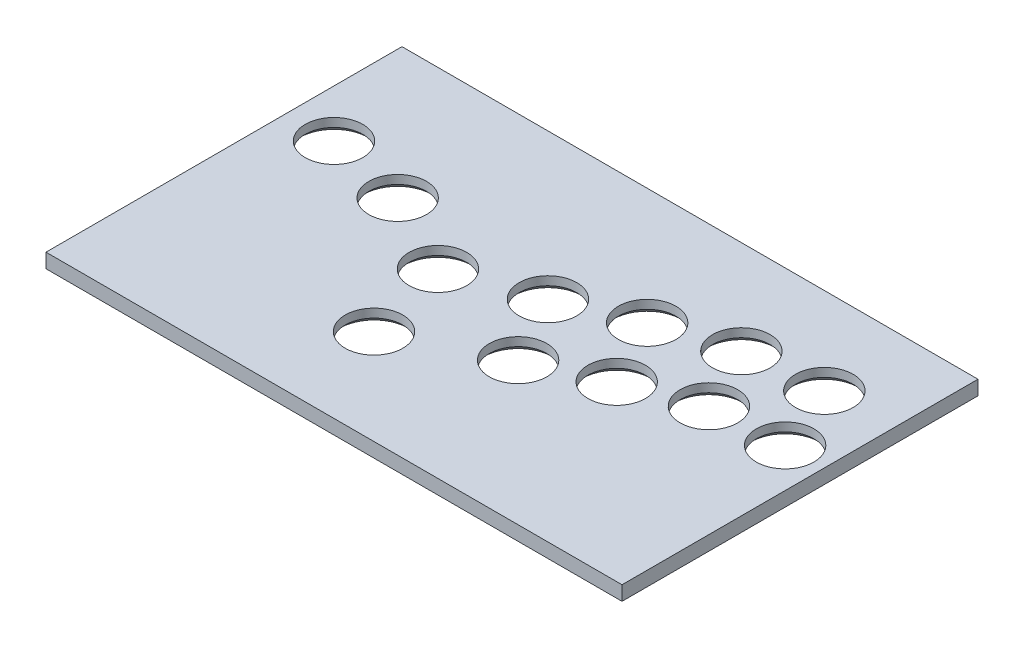
from build123d import *

# Parameters (mm, degrees)
SKETCH1_W           = 200
SKETCH1_H           = 123.6
SKETCH1_R           = 10
BOSS_EXTRUDE1_DEPTH = 5
CHAMFER1_SIZE       = 2


with BuildPart() as part:
    # Sketch1 → Boss-Extrude1 (new body)
    with BuildSketch(Plane(origin=(0, 0, 0), x_dir=(1, 0, 0), z_dir=(0, 1, 0))):
        with Locations((-11.382571905, -37.613815878)):
            Rectangle(SKETCH1_W, SKETCH1_H)
        with Locations(Location((-30.546222192, -66.351509684, 0), (0, 0, 270))):
            Circle(SKETCH1_R, mode=Mode.SUBTRACT)
        with Locations(Location((-66.632534539, -22.057178609, 0), (0, 0, 270))):
            Circle(SKETCH1_R, mode=Mode.SUBTRACT)
        with Locations(Location((-94.823650655, -15.979370187, 0), (0, 0, 270))):
            Circle(SKETCH1_R, mode=Mode.SUBTRACT)
        with Locations(Location((-10.090347172, -26.425303761, 0), (0, 0, 270))):
            Circle(SKETCH1_R, mode=Mode.SUBTRACT)
        with Locations(Location((65.449469323, -6.002101711, 0), (0, 0, 270))):
            Circle(SKETCH1_R, mode=Mode.SUBTRACT)
        with Locations(Location((39.120524561, -8.47636758, 0), (0, 0, 270))):
            Circle(SKETCH1_R, mode=Mode.SUBTRACT)
        with Locations(Location((3.050131898, -49.923740932, 0), (0, 0, 270))):
            Circle(SKETCH1_R, mode=Mode.SUBTRACT)
        with Locations(Location((26.684644812, -39.329734959, 0), (0, 0, 270))):
            Circle(SKETCH1_R, mode=Mode.SUBTRACT)
        with Locations(Location((50.034895937, -30.657694114, 0), (0, 0, 270))):
            Circle(SKETCH1_R, mode=Mode.SUBTRACT)
        with Locations(Location((-38.286901535, -36.422907606, 0), (0, 0, 270))):
            Circle(SKETCH1_R, mode=Mode.SUBTRACT)
        with Locations(Location((75.040753418, -29.205017129, 0), (0, 0, 270))):
            Circle(SKETCH1_R, mode=Mode.SUBTRACT)
        with Locations(Location((14.228770638, -16.291965116, 0), (0, 0, 270))):
            Circle(SKETCH1_R, mode=Mode.SUBTRACT)
    extrude(amount=BOSS_EXTRUDE1_DEPTH)

    # Chamfer1
    chamfer1_edges = [part.edges().sort_by_distance(p)[0] for p in [
        (-30.546222192, 0, 56.351509684),
        (-66.632534539, 0, 12.057178609),
        (-94.823650655, 0, 5.979370187),
        (-10.090347172, 0, 16.425303761),
        (65.449469323, 0, -3.997898289),
        (39.120524561, 0, -1.52363242),
        (3.050131898, 0, 39.923740932),
        (26.684644812, 0, 29.329734959),
        (50.034895937, 0, 20.657694114),
        (-38.286901535, 0, 26.422907606),
        (75.040753418, 0, 19.205017129),
        (14.228770638, 0, 6.291965116),
    ]]
    chamfer(chamfer1_edges, length=CHAMFER1_SIZE)


solid = part.part
